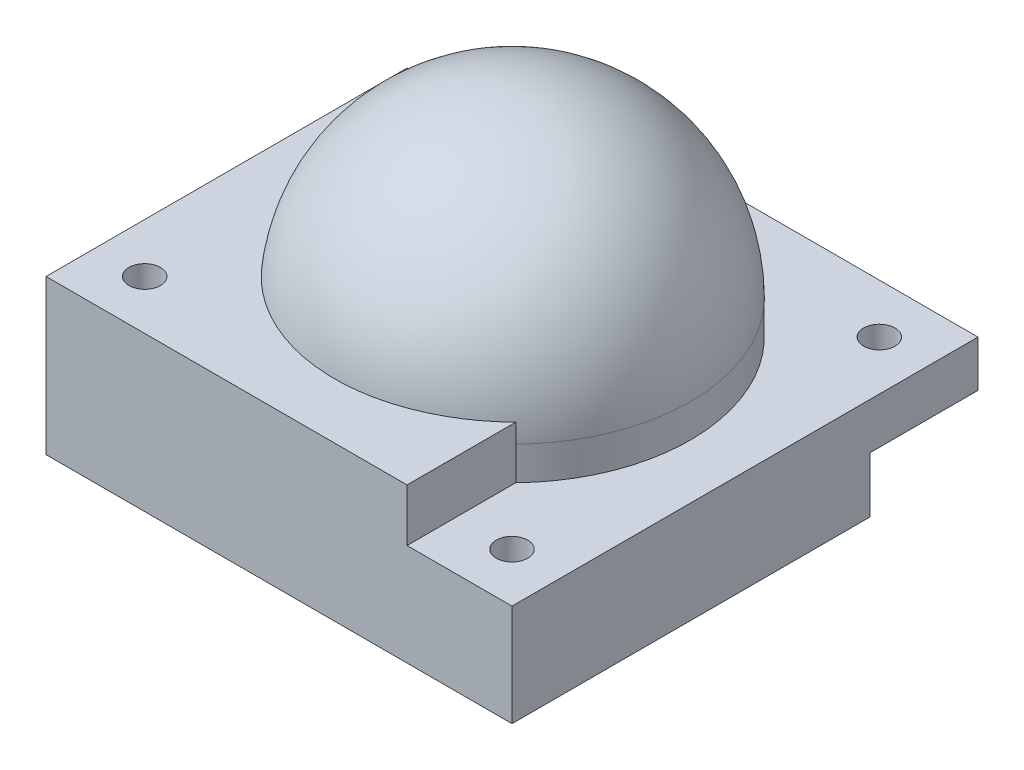
from build123d import *

# Parameters (mm, degrees)
SKETCH3_W               = 44.4
SKETCH3_H               = 44.4
BOSS_EXTRUDE1_DEPTH     = 9.7
SKETCH4_W               = 10.3
SKETCH4_H               = 10.3
CUT_EXTRUDE1_DEPTH      = 5.3
SKETCH5_R               = 6
CUT_EXTRUDE2_DEPTH      = 14.3
BOSS_EXTRUDE2_DEPTH     = 5
CUT_EXTRUDE3_DEPTH      = 35.870626966
CUT_EXTRUDE3_DEPTH_BACK = 35.870626966
SKETCH7_R               = 1.5


with BuildPart() as part:
    # Sketch2 → Revolve1 (revolve)
    with BuildSketch(Plane.XY, mode=Mode.PRIVATE) as revolve1_sk:
        with BuildLine():
            Line((-10, 0), (-12, 0))
            ThreePointArc((-12, 0), (-8.485281374, 8.485281374), (0, 12))
            Line((0, 12), (0, 17))
            ThreePointArc((0, 17), (-12.02081528, 12.02081528), (-17, 0))
            Line((-17, 0), (-17, -3.175))
            Line((-17, -3.175), (-10, -3.175))
            Line((-10, -3.175), (-10, 0))
        make_face()
    revolve(revolve1_sk.sketch.rotate(Axis((0, 12, 0), (0, 1, 0)), 180), axis=Axis((0, 12, 0), (0, 1, 0)))

    # Sketch3 → Boss-Extrude1 (add)
    with BuildSketch(Plane.XZ.offset(3.175)):
        Rectangle(SKETCH3_W, SKETCH3_H)
    extrude(amount=BOSS_EXTRUDE1_DEPTH)

    # Sketch4 → Cut-Extrude1 (cut)
    with BuildSketch(Plane.XZ.offset(12.875)):
        with Locations((17.05, -17.05)):
            Rectangle(SKETCH4_W, SKETCH4_H)
    extrude(amount=-CUT_EXTRUDE1_DEPTH, mode=Mode.SUBTRACT)

    # Sketch5 → Cut-Extrude2 (cut)
    with BuildSketch(Plane.XZ.offset(12.875)):
        Circle(SKETCH5_R)
    extrude(amount=-CUT_EXTRUDE2_DEPTH, mode=Mode.SUBTRACT)

    # Sketch6 → Boss-Extrude2 (add)
    with BuildSketch(Plane(origin=(0, -3.175, 0), x_dir=(1, 0, 0), z_dir=(0, 1, 0))):
        with BuildLine():
            Line((-22.2, -22.2), (-22.2, 12.2))
            Line((-22.2, 12.2), (-11.83, 12.2))
            ThreePointArc((-11.83, 12.2), (-11.83, -11.83), (12.2, -11.83))
            Line((12.2, -11.83), (12.2, -22.2))
            Line((12.2, -22.2), (-22.2, -22.2))
        make_face()
    extrude(amount=BOSS_EXTRUDE2_DEPTH)

    # Sketch7 → Cut-Extrude3 (cut, two sides: drawn at the far end of the back side and taken through both)
    with BuildSketch(Plane(origin=(0, 1.825, 0), x_dir=(1, 0, 0), z_dir=(0, 1, 0)).offset(-CUT_EXTRUDE3_DEPTH_BACK)):
        with Locations(Location((-17.5, -17.5, 0), (0, 0, 180))):
            Circle(SKETCH7_R)
        with Locations(Location((17.5, -17.5, 0), (0, 0, 180))):
            Circle(SKETCH7_R)
        with Locations(Location((17.5, 17.5, 0), (0, 0, 180))):
            Circle(SKETCH7_R)
        with Locations(Location((-17.5, 17.5, 0), (0, 0, 180))):
            Circle(SKETCH7_R)
    extrude(amount=CUT_EXTRUDE3_DEPTH + CUT_EXTRUDE3_DEPTH_BACK, mode=Mode.SUBTRACT)


solid = part.part
